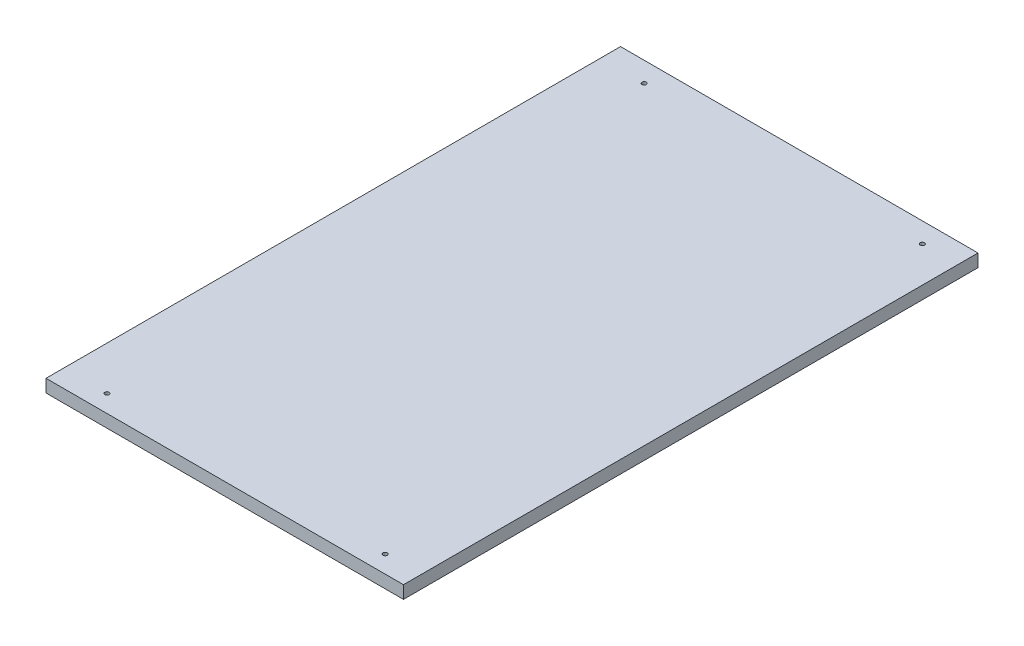
from build123d import *

# Parameters (mm, degrees)
ESBO_O1_W                   = 84
ESBO_O1_H                   = 135
RESSALTO_EXTRUS_O1_DEPTH    = 3
FUROS_GUIA_COM_1_0MM4_D     = 1
FUROS_GUIA_COM_1_0MM4_DEPTH = 3
FUROS_GUIA_COM_1_0MM4_TIP   = 0.30043031


with BuildPart() as part:
    # Esboço1 → Ressalto-extrusão1 (new body)
    with BuildSketch(Plane(origin=(0, 0, 0), x_dir=(1, 0, 0), z_dir=(0, 1, 0))):
        Rectangle(ESBO_O1_W, ESBO_O1_H)
    extrude(amount=RESSALTO_EXTRUS_O1_DEPTH)

    # Furos-guia com Ø1.0mm4
    with Locations(Plane(origin=(0, 3, 0), x_dir=(1, 0, 0), z_dir=(0, 1, 0))):
        with Locations((-31.749623822, 62.801740386), (33.621619811, 62.801740386), (-31.749623822, -63.429295078), (33.621619811, -63.429295078)):
            Hole(FUROS_GUIA_COM_1_0MM4_D / 2, depth=FUROS_GUIA_COM_1_0MM4_DEPTH)
            with Locations((0, 0, -(FUROS_GUIA_COM_1_0MM4_DEPTH + FUROS_GUIA_COM_1_0MM4_TIP / 2))):  # 118° drill point
                Cone(0, FUROS_GUIA_COM_1_0MM4_D / 2, FUROS_GUIA_COM_1_0MM4_TIP, mode=Mode.SUBTRACT)


solid = part.part
